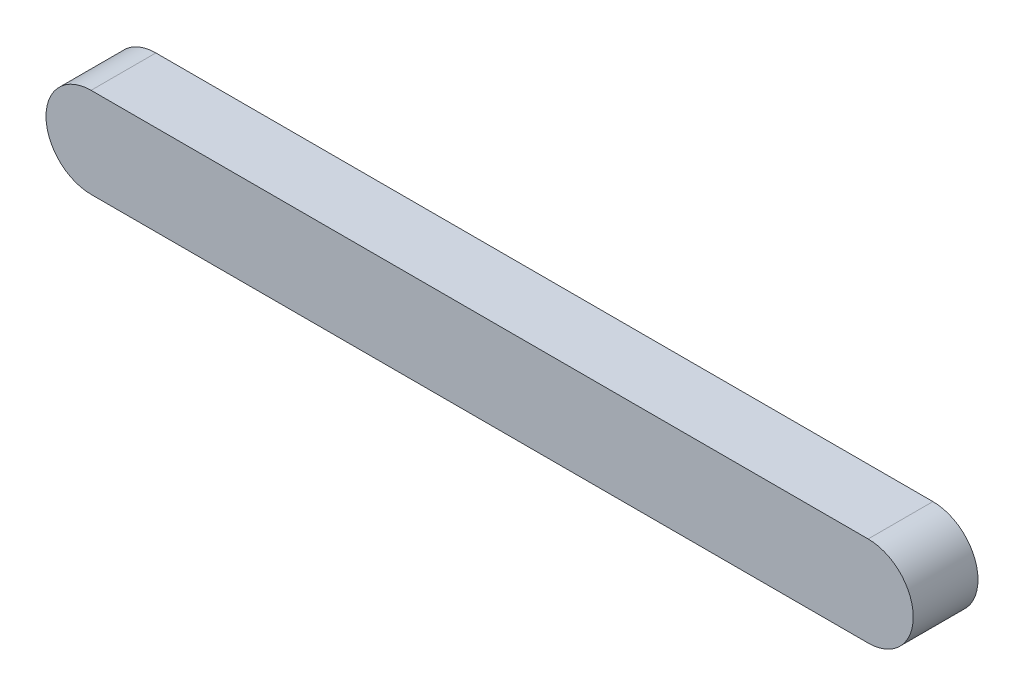
from build123d import *

# Parameters (mm, degrees)
EXTRUDE_1_DEPTH = 10


with BuildPart() as part:
    # 草图1 → 凸台-拉伸1 (new body)
    with BuildSketch(Plane.XY):
        with BuildLine():
            Line((0, 6.962775782), (120, 6.962775782))
            ThreePointArc((120, 6.962775782), (126.962775782, 0), (120, -6.962775782))
            Line((120, -6.962775782), (0, -6.962775782))
            ThreePointArc((0, -6.962775782), (-6.962775782, 0), (0, 6.962775782))
        make_face()
    extrude(amount=EXTRUDE_1_DEPTH)


solid = part.part
